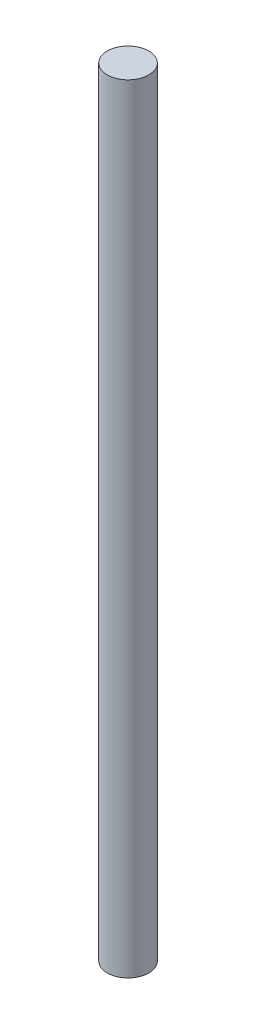
from build123d import *

# Parameters (mm, degrees)
SKETCH1_W = 1.6
SKETCH1_H = 60


with BuildPart() as part:
    # Sketch1 → Revolve1 (revolve)
    with BuildSketch(Plane.XY, mode=Mode.PRIVATE) as revolve1_sk:
        with Locations((-0.8, 30)):
            Rectangle(SKETCH1_W, SKETCH1_H)
    revolve(revolve1_sk.sketch.rotate(Axis((0, -10.2, 0), (0, 1, 0)), 270), axis=Axis((0, -10.2, 0), (0, 1, 0)))


solid = part.part
